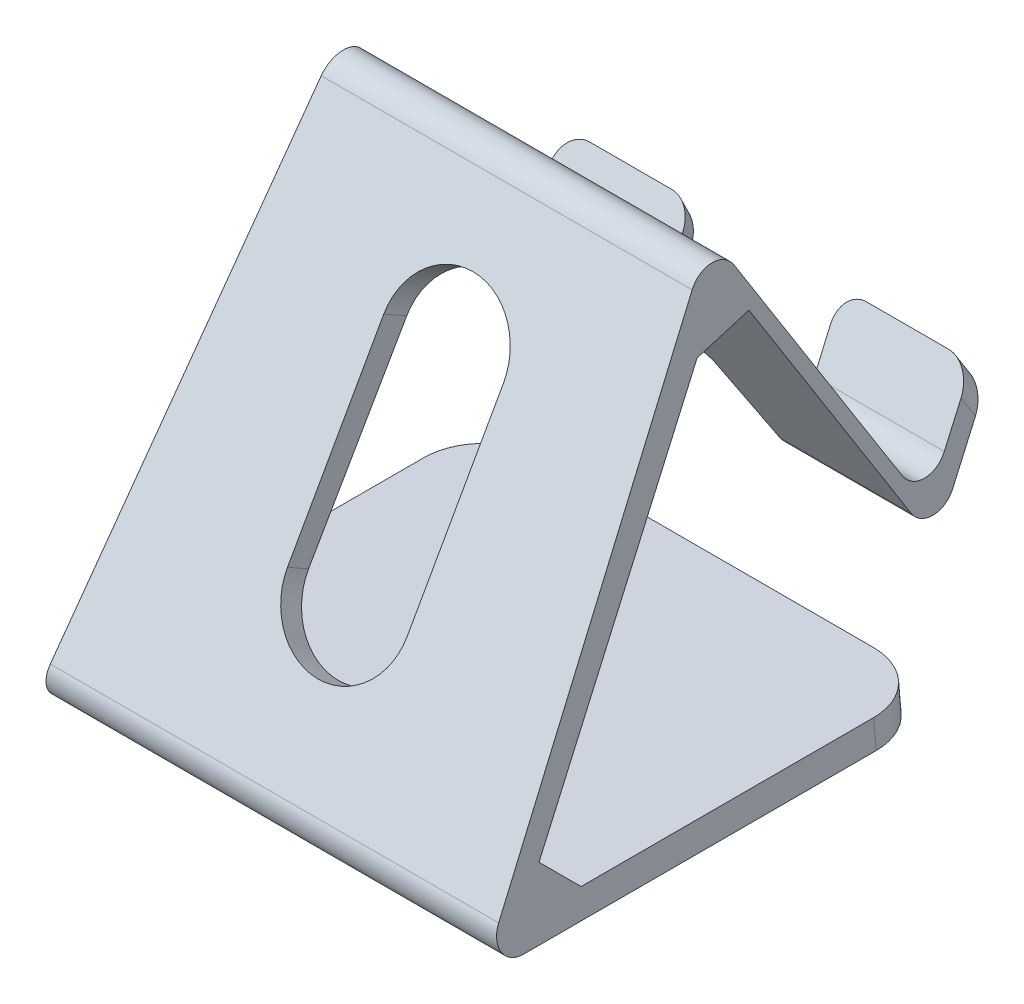
from build123d import *
from OCP.BRepFilletAPI import BRepFilletAPI_MakeChamfer

# Parameters (mm, degrees)
EXTRUDE_2_DEPTH                 = 37.5
CUT_EXTRUDE_7_DEPTH             = 103.837497834
CUT_EXTRUDE_7_DEPTH_BACK        = 103.837497834
CUT_EXTRUDE_3_DEPTH             = 103.837497834
CUT_EXTRUDE_3_DEPTH_BACK        = 103.837497834
CUT_EXTRUDE_4_REACH             = 108.804
CUT_EXTRUDE_4_DIRECTION_2_DEPTH = 107.803974103
FILLET_1_R                      = 10
FILLET_2_R                      = 10
CHAMFER_1_SIZE                  = 10
CHAMFER_1_SIZE2                 = 7.348769571
CHAMFER_1_SIZE2_2               = 7.320508076
FILLET_4_R                      = 4
FILLET_5_R                      = 4
FILLET_6_R                      = 4
FILLET_7_R                      = 4
FILLET_8_R                      = 4
CUT_EXTRUDE_5_REACH             = 86.613
FILLET_9_R                      = 4
CUT_EXTRUDE_19_DEPTH            = 0.5


with BuildPart() as part:
    # 草图1 → 凸台-拉伸2 (new, symmetric)
    with BuildSketch(Plane(origin=(0, 0, 0), x_dir=(0, 0, -1), z_dir=(1, 0, 0))):
        Polygon((-69.337215993, -13.957199945), (5.662784007, -13.957199945), (5.662784007, -9.457199945), (-62.541106353, -9.457199945), (-37.306862797, 34.249791985), (-22.77752063, 59.415350818), (-6.506208301, 32.121536588), (7.539405244, 8.561152577), (17.593990312, 25.976204763), (15.540885381, 29.420122711), (6.662784007, 14.042800055), (-24.337215993, 66.042800055), align=None)
    extrude(amount=EXTRUDE_2_DEPTH, both=True)

    # 草图3 → 切除-拉伸-薄壁7 (cut, two sides: drawn at the far end of the back side and taken through both)
    with BuildSketch(Plane.XY.offset(-CUT_EXTRUDE_7_DEPTH_BACK)):
        Polygon((-30, 66.042800055), (-37.5, -13.957199945), (-47.456342261, -13.023792858), (-39.956342261, 66.976207142), align=None)
    extrude(amount=CUT_EXTRUDE_7_DEPTH + CUT_EXTRUDE_7_DEPTH_BACK, mode=Mode.SUBTRACT)

    # 草图5 → 切除-拉伸3 (cut, two sides: drawn at the far end of the back side and taken through both)
    with BuildSketch(Plane.XY.offset(-CUT_EXTRUDE_3_DEPTH_BACK)):
        Polygon((37.5, 66.042800055), (37.5, -13.957199945), (30, 66.042800055), align=None)
    extrude(amount=CUT_EXTRUDE_3_DEPTH + CUT_EXTRUDE_3_DEPTH_BACK, mode=Mode.SUBTRACT)

    # 草图7 → 切除-拉伸4 (cut, up to next)
    with BuildSketch(Plane(origin=(0, 6.612698137, -11.092267843), x_dir=(-1, 0, 0), z_dir=(0, 0.5120645423166438, -0.8589469742085631)), mode=Mode.PRIVATE) as cut_extrude_4_sk1:
        Polygon((-10, 28.600496992), (10, 28.600496992), (15, 0), (-15, 0), align=None)
    cut_extrude_4_tool1 = extrude(cut_extrude_4_sk1.sketch, amount=-CUT_EXTRUDE_4_REACH, mode=Mode.PRIVATE) & part.part
    add(cut_extrude_4_tool1.solids().sort_by_distance((0, 18.076976, -4.257794))[0], mode=Mode.SUBTRACT)

    # 草图7 → 切除-拉伸4 direction 2 (cut)
    with BuildSketch(Plane(origin=(0, 6.612698137, -11.092267843), x_dir=(-1, 0, 0), z_dir=(0, 0.5120645423166438, -0.8589469742085631))):
        Polygon((-10, 28.600496992), (10, 28.600496992), (15, 0), (-15, 0), align=None)
    extrude(amount=CUT_EXTRUDE_4_DIRECTION_2_DEPTH, mode=Mode.SUBTRACT)

    # 圆角1
    fillet_1_edges = [part.edges().sort_by_distance(p)[0] for p in [
        (37.2890625, -11.707199945, -5.662784007),
    ]]
    fillet(fillet_1_edges, radius=FILLET_1_R)

    # 圆角2
    fillet_2_edges = [part.edges().sort_by_distance(p)[0] for p in [
        (-37.2890625, -11.707199945, -5.662784007),
    ]]
    fillet(fillet_2_edges, radius=FILLET_2_R)

    # 倒角1: one chamfer whose edges measure the first distance from different faces: ONE call of the kernel's chamfer builder (chamfer() names one face for all edges)
    chamfer_1_edges_1 = [part.edges().sort_by_distance(p)[0] for p in [
        (0, 59.415350818, 22.77752063),
    ]]
    chamfer_1_side_1 = [part.faces().sort_by_distance(p)[0] for p in [
        (0, 23.884294487, 43.291385568),
    ]]
    chamfer_1_edges_2 = [part.edges().sort_by_distance(p)[0] for p in [
        (0, -9.457199945, 62.541106353),
    ]]
    chamfer_1_side_2 = [part.faces().sort_by_distance(p)[0] for p in [
        (0, -9.457199945, 28.713118307),
    ]]
    chamfer_1 = BRepFilletAPI_MakeChamfer(part.part.solid().wrapped)
    for e in chamfer_1_edges_1:
        chamfer_1.Add(CHAMFER_1_SIZE, CHAMFER_1_SIZE2, e.wrapped, chamfer_1_side_1[0].wrapped)  # the first distance lies on this face
    for e in chamfer_1_edges_2:
        chamfer_1.Add(CHAMFER_1_SIZE, CHAMFER_1_SIZE2_2, e.wrapped, chamfer_1_side_2[0].wrapped)  # the first distance lies on this face
    add(Compound.cast(chamfer_1.Shape()), mode=Mode.REPLACE)

    # 圆角4
    fillet_4_edges = [part.edges().sort_by_distance(p)[0] for p in [
        (0, -13.957199945, 69.337215993),
    ]]
    fillet(fillet_4_edges, radius=FILLET_4_R)

    # 圆角5
    fillet_5_edges = [part.edges().sort_by_distance(p)[0] for p in [
        (0, 66.042800055, 24.337215993),
    ]]
    fillet(fillet_5_edges, radius=FILLET_5_R)

    # 圆角6
    fillet_6_edges = [part.edges().sort_by_distance(p)[0] for p in [
        (24.181372827, 14.042800055, -6.662784007),
        (-24.181372827, 14.042800055, -6.662784007),
    ]]
    fillet(fillet_6_edges, radius=FILLET_6_R)

    # 圆角7
    fillet_7_edges = [part.edges().sort_by_distance(p)[0] for p in [
        (24.88913288, 8.561152577, -7.539405244),
        (-24.88913288, 8.561152577, -7.539405244),
    ]]
    fillet(fillet_7_edges, radius=FILLET_7_R)

    # 圆角8
    fillet_8_edges = [part.edges().sort_by_distance(p)[0] for p in [
        (12.323882788, 27.698163737, -16.567437846),
        (-12.323882788, 27.698163737, -16.567437846),
        (-33.594809655, 27.698163737, -16.567437846),
        (33.594809655, 27.698163737, -16.567437846),
    ]]
    fillet(fillet_8_edges, radius=FILLET_8_R)

    # 切除-拉伸5: up to this plane
    cut_extrude_5_end = Plane(origin=(37.5, 34.249791985, 37.306862797), z_dir=(0, 0.5000000000000044, 0.8660254037844362))
    # 草图8 → 切除-拉伸5 (cut, up to the surface)
    with BuildSketch(Plane(origin=(0, 26.273073909, 46.70768695), x_dir=(1, 0, 0), z_dir=(0, 0.4902612396325587, 0.8715755371245495)), mode=Mode.PRIVATE) as cut_extrude_5_sk1:
        with BuildLine():
            Line((9.862156139, 17.515327615), (9.862156139, -14.832544522))
            ThreePointArc((9.862156139, -14.832544522), (0, -24.694700661), (-9.862156139, -14.832544522))
            Line((-9.862156139, -14.832544522), (-9.862156139, 17.515327615))
            ThreePointArc((-9.862156139, 17.515327615), (0, 27.377483754), (9.862156139, 17.515327615))
        make_face()
    cut_extrude_5_tool1 = split(extrude(cut_extrude_5_sk1.sketch, amount=-CUT_EXTRUDE_5_REACH, mode=Mode.PRIVATE), bisect_by=cut_extrude_5_end, keep=Keep.BOTH, mode=Mode.PRIVATE)
    add(cut_extrude_5_tool1.solids().sort_by_distance((0, 27.442198, 46.050055))[0], mode=Mode.SUBTRACT)

    # 圆角9
    fillet_9_edges = [part.edges().sort_by_distance(p)[0] for p in [
        (10, 30.653121751, 4.435165153),
        (-10, 30.653121751, 4.435165153),
    ]]
    fillet(fillet_9_edges, radius=FILLET_9_R)

    # 草图9 → 切除-拉伸19 (cut)
    # profile 1 of 2: a face of its own
    with BuildSketch(Plane(origin=(0, 6.612698137, -11.092267843), x_dir=(-1, 0, 0), z_dir=(0, 0.5120645423166438, -0.8589469742085631))):
        with BuildLine():
            add(Edge.make_bspline(
                [(-6.606037662, 38.953429024), (-5.711334874, 40.311243339), (-3.854311729, 43.564154073), (-0.858400361, 45.826493842), (0.468870754, 47.38516919)],
                knots=[0, 0, 0, 0, 0.444342779, 1, 1, 1, 1], degree=3))
            add(Edge.make_bspline(
                [(-6.606037662, 38.953429024), (-9.378559135, 35.780697287), (-14.751433674, 24.057721204), (-5.055372805, 30.986280975)],
                knots=[0, 0, 0, 0, 0.897758924, 0.897758924, 0.897758924, 0.897758924], degree=3))
            add(Edge.make_bspline(
                [(-5.055372805, 30.986280975), (-3.951139058, 31.775338472), (-2.651465095, 32.806301591), (-1.130252381, 34.119348895)],
                knots=[0.897758924, 0.897758924, 0.897758924, 0.897758924, 1, 1, 1, 1], degree=3))
            add(Edge.make_bspline(
                [(6.332322248, 42.490883232), (6.421345736, 41.744828612), (6.344182877, 40.360506044), (6.000591752, 38.579631764), (5.252680808, 37.443200943), (4.475701743, 36.345853392), (3.207138679, 35.357882181), (1.705465876, 34.34846817), (0.163062797, 33.924083238), (-0.754774414, 34.050408523), (-1.130252381, 34.119348895)],
                knots=[0, 0, 0, 0, 0.117072849, 0.219314974, 0.278544439, 0.329333286, 0.430146269, 0.52813716, 0.613566108, 0.673160343, 0.673160343, 0.673160343, 0.673160343], degree=3))
            add(Edge.make_bspline(
                [(0.468870754, 47.38516919), (1.233033198, 47.922620622), (2.49626224, 49.235976382), (4.241552698, 50.722199927), (5.757086701, 51.611825239), (6.890776807, 52.349356015), (7.979867228, 52.911105038), (9.009325049, 52.897932667), (9.772550935, 52.701828247), (10.268614434, 51.887019071), (10.101877149, 50.633458002), (9.70577606, 48.904902538), (8.623104825, 46.001853987), (7.426413078, 43.809596625), (6.332322248, 42.490883232)],
                knots=[0, 0, 0, 0, 0.125072756, 0.245842542, 0.307491057, 0.361289695, 0.429653226, 0.46668336, 0.499065273, 0.530480343, 0.584936423, 0.663141117, 0.772009703, 1, 1, 1, 1], degree=3))
        make_face()
        with BuildLine():
            add(Edge.make_bspline(
                [(-5.925793934, 36.893896271), (-6.314452071, 36.418621882), (-10.90174323, 28.38229129), (-2.668424669, 33.749192184), (-2.77783358, 34.475014711)],
                knots=[0, 0, 0, 0, 0.486390134, 1, 1, 1, 1], degree=3))
            add(Edge.make_bspline(
                [(-2.77783358, 34.475014711), (-2.957051517, 34.52370524), (-3.778444373, 34.774634797), (-5.022215854, 35.454494355), (-5.730155434, 36.410802759), (-5.925793934, 36.893896271)],
                knots=[0.761269827, 0.761269827, 0.761269827, 0.761269827, 0.790511254, 0.896348436, 0.975855606, 0.975855606, 0.975855606, 0.975855606], degree=3))
        make_face(mode=Mode.SUBTRACT)
        with BuildLine():
            add(Edge.make_bspline(
                [(-5.704606663, 37.354305889), (-4.82005562, 39.114963546), (-2.167848058, 42.452443751), (1.487716627, 44.915381127), (3.771169156, 45.300026951)],
                knots=[0.035918318, 0.035918318, 0.035918318, 0.035918318, 0.452487374, 0.939525842, 0.939525842, 0.939525842, 0.939525842], degree=3))
            add(Edge.make_bspline(
                [(-5.704606663, 37.354305889), (-4.903172884, 35.848608285), (-2.06778183, 33.826601764), (2.360384852, 34.966954875), (4.576007986, 37.506203367), (6.220363831, 40.221899193), (5.250367062, 43.052302972), (4.513305616, 44.655132724), (3.771169156, 45.300026951)],
                knots=[0, 0, 0, 0, 0.248218278, 0.43884002, 0.59987409, 0.733439298, 0.868620911, 1, 1, 1, 1], degree=3))
        make_face(mode=Mode.SUBTRACT)
    # profile 2 of 2: a face of its own
    with BuildSketch(Plane(origin=(0, 6.612698137, -11.092267843), x_dir=(-1, 0, 0), z_dir=(0, 0.5120645423166438, -0.8589469742085631))):
        with BuildLine():
            add(Edge.make_bspline(
                [(-6.606037662, 38.953429024), (-6.857731684, 39.967243119), (-6.66251098, 41.958089443), (-5.736175757, 44.327135585), (-4.335162577, 45.931678579), (-2.409061861, 47.170333165), (-0.663837917, 47.683486872), (0.468870754, 47.38516919)],
                knots=[0, 0, 0, 0, 0.241647458, 0.464965071, 0.586300838, 0.737202049, 1, 1, 1, 1], degree=3))
            add(Edge.make_bspline(
                [(-6.606037662, 38.953429024), (-5.711334874, 40.311243339), (-3.854311729, 43.564154073), (-0.858400361, 45.826493842), (0.468870754, 47.38516919)],
                knots=[0, 0, 0, 0, 0.444342779, 1, 1, 1, 1], degree=3))
        make_face()
    extrude(amount=-CUT_EXTRUDE_19_DEPTH, mode=Mode.SUBTRACT)


solid = part.part
